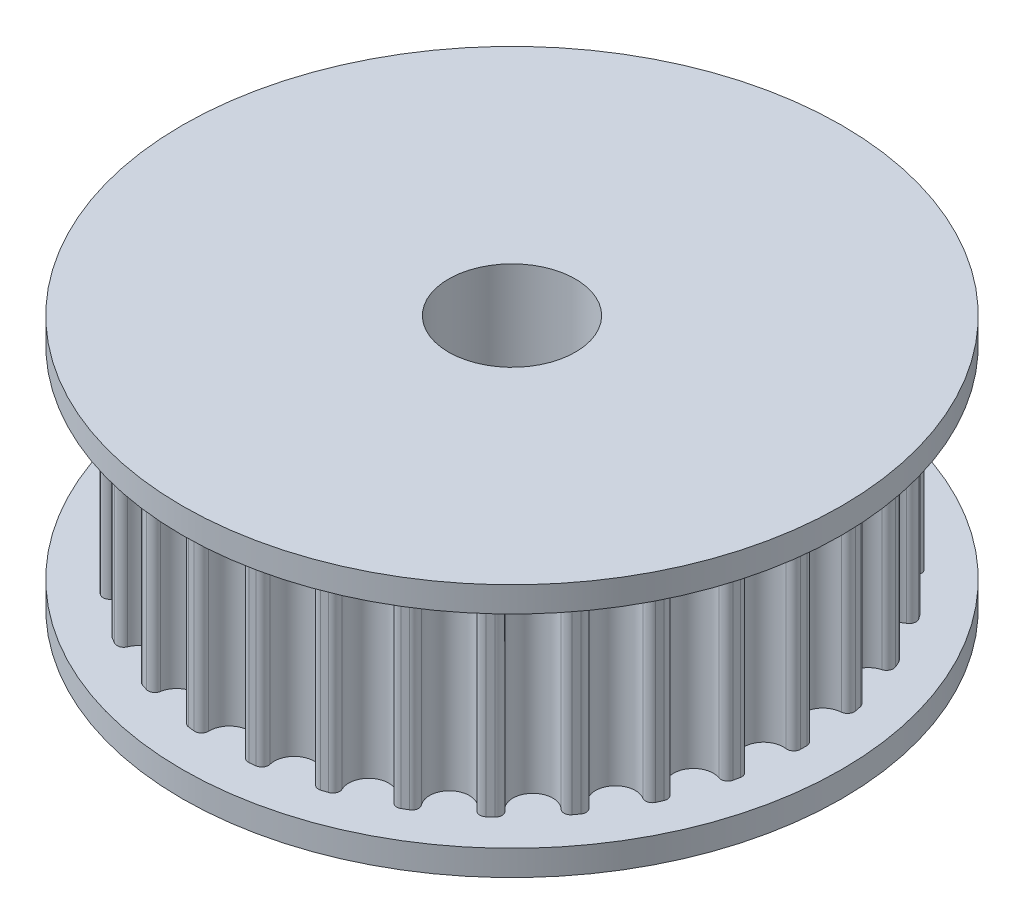
from build123d import *

# Parameters (mm, degrees)
SKETCH1_R           = 5
BOSS_EXTRUDE1_DEPTH = 8
SKETCH2_R           = 26
SKETCH2_R_2         = 5
BOSS_EXTRUDE3_DEPTH = 2


with BuildPart() as part:
    # Sketch1 → Boss-Extrude1 (new, symmetric)
    with BuildSketch(Plane(origin=(0, 0, 0), x_dir=(1, 0, 0), z_dir=(0, 1, 0))):
        with BuildLine():
            ThreePointArc((22.392975349, 0.771229223), (20.603750247, 2.165541413), (22.063982683, 3.901385353))
            ThreePointArc((22.063982683, 3.901385353), (22.451945402, 4.109740228), (22.551013278, 4.538823415))
            ThreePointArc((22.551013278, 4.538823415), (22.526119248, 4.660801376), (22.500565447, 4.782642827))
            ThreePointArc((22.500565447, 4.782642827), (22.474352623, 4.904344198), (22.447481544, 5.025901925))
            ThreePointArc((22.447481544, 5.025901925), (22.182454682, 5.377594386), (21.74328754, 5.410137381))
            ThreePointArc((21.74328754, 5.410137381), (19.703267494, 6.401979689), (20.770688099, 8.403490669))
            ThreePointArc((20.770688099, 8.403490669), (21.106853488, 8.687954474), (21.114545081, 9.128258533))
            ThreePointArc((21.114545081, 9.128258533), (21.064834401, 9.242395224), (21.01450675, 9.356261213))
            ThreePointArc((21.01450675, 9.356261213), (20.963563602, 9.469853164), (20.912006448, 9.583167752))
            ThreePointArc((20.912006448, 9.583167752), (20.579650084, 9.872072706), (20.143313728, 9.812596575))
            ThreePointArc((20.143313728, 9.812596575), (17.941657404, 10.358620732), (18.569614776, 12.538323118))
            ThreePointArc((18.569614776, 12.538323118), (18.839290794, 12.886463421), (18.755269946, 13.318744952))
            ThreePointArc((18.755269946, 13.318744952), (18.682915211, 13.420052051), (18.61001327, 13.520966087))
            ThreePointArc((18.61001327, 13.520966087), (18.536566257, 13.621484106), (18.462576323, 13.721603163))
            ThreePointArc((18.462576323, 13.721603163), (18.077416025, 13.935094077), (17.662980449, 13.786198213))
            ThreePointArc((17.662980449, 13.786198213), (15.395910792, 13.862540343), (15.55696018, 16.12517068))
            ThreePointArc((15.55696018, 16.12517068), (15.748360691, 16.521772079), (15.576299516, 16.927138306))
            ThreePointArc((15.576299516, 16.927138306), (15.484462976, 17.011188206), (15.392172909, 17.094739863))
            ThreePointArc((15.392172909, 17.094739863), (15.299432018, 17.177790829), (15.206243019, 17.260338672))
            ThreePointArc((15.206243019, 17.260338672), (14.785112141, 17.389084969), (14.410690168, 17.157276836))
            ThreePointArc((14.410690168, 17.157276836), (12.177289001, 16.760600421), (11.864391774, 19.007270908))
            ThreePointArc((11.864391774, 19.007270908), (11.969151657, 19.435000018), (11.716570054, 19.79573449))
            ThreePointArc((11.716570054, 19.79573449), (11.609265406, 19.858853808), (11.501620732, 19.921391477))
            ThreePointArc((11.501620732, 19.921391477), (11.393639185, 19.983345665), (11.285323928, 20.044714557))
            ThreePointArc((11.285323928, 20.044714557), (10.84662791, 20.083089406), (10.528583576, 19.77850013))
            ThreePointArc((10.528583576, 19.77850013), (8.426461247, 18.926141834), (7.653292516, 21.058662189))
            ThreePointArc((7.653292516, 21.058662189), (7.666833261, 21.498825197), (7.344770259, 21.799162087))
            ThreePointArc((7.344770259, 21.799162087), (7.22668723, 21.838592206), (7.108392538, 21.87738269))
            ThreePointArc((7.108392538, 21.87738269), (6.989889647, 21.915532404), (6.871182028, 21.953040231))
            ThreePointArc((6.871182028, 21.953040231), (6.434093991, 21.899366466), (6.18632736, 21.535308062))
            ThreePointArc((6.18632736, 21.535308062), (4.307356702, 20.264520032), (3.10770765, 22.189688882))
            ThreePointArc((3.10770765, 22.189688882), (3.029437462, 22.623048551), (2.651968758, 22.849861696))
            ThreePointArc((2.651968758, 22.849861696), (2.528268145, 22.86387933), (2.40449348, 22.8772273))
            ThreePointArc((2.40449348, 22.8772273), (2.28064839, 22.889905215), (2.156736502, 22.901912704))
            ThreePointArc((2.156736502, 22.901912704), (1.74035929, 22.758536127), (1.573698953, 22.350919693))
            ThreePointArc((1.573698953, 22.350919693), (0, 20.717241464), (-1.573698953, 22.350919693))
            ThreePointArc((-1.573698953, 22.350919693), (-1.74035929, 22.758536127), (-2.156736502, 22.901912704))
            ThreePointArc((-2.156736502, 22.901912704), (-2.28064839, 22.889905215), (-2.40449348, 22.8772273))
            ThreePointArc((-2.40449348, 22.8772273), (-2.528268145, 22.86387933), (-2.651968758, 22.849861696))
            ThreePointArc((-2.651968758, 22.849861696), (-3.029437462, 22.623048551), (-3.10770765, 22.189688882))
            ThreePointArc((-3.10770765, 22.189688882), (-4.307356702, 20.264520032), (-6.18632736, 21.535308062))
            ThreePointArc((-6.18632736, 21.535308062), (-6.434093991, 21.899366466), (-6.871182028, 21.953040231))
            ThreePointArc((-6.871182028, 21.953040231), (-6.989889647, 21.915532404), (-7.108392538, 21.87738269))
            ThreePointArc((-7.108392538, 21.87738269), (-7.22668723, 21.838592206), (-7.344770259, 21.799162087))
            ThreePointArc((-7.344770259, 21.799162087), (-7.666833261, 21.498825197), (-7.653292516, 21.058662189))
            ThreePointArc((-7.653292516, 21.058662189), (-8.426461247, 18.926141834), (-10.528583576, 19.77850013))
            ThreePointArc((-10.528583576, 19.77850013), (-10.84662791, 20.083089406), (-11.285323928, 20.044714557))
            ThreePointArc((-11.285323928, 20.044714557), (-11.393639185, 19.983345665), (-11.501620732, 19.921391477))
            ThreePointArc((-11.501620732, 19.921391477), (-11.609265406, 19.858853808), (-11.716570054, 19.79573449))
            ThreePointArc((-11.716570054, 19.79573449), (-11.969151657, 19.435000018), (-11.864391774, 19.007270908))
            ThreePointArc((-11.864391774, 19.007270908), (-12.177289001, 16.760600421), (-14.410690168, 17.157276836))
            ThreePointArc((-14.410690168, 17.157276836), (-14.785112141, 17.389084969), (-15.206243019, 17.260338672))
            ThreePointArc((-15.206243019, 17.260338672), (-15.299432018, 17.177790829), (-15.392172909, 17.094739863))
            ThreePointArc((-15.392172909, 17.094739863), (-15.484462976, 17.011188206), (-15.576299516, 16.927138306))
            ThreePointArc((-15.576299516, 16.927138306), (-15.748360691, 16.521772079), (-15.55696018, 16.12517068))
            ThreePointArc((-15.55696018, 16.12517068), (-15.395910792, 13.862540343), (-17.662980449, 13.786198213))
            ThreePointArc((-17.662980449, 13.786198213), (-18.077416025, 13.935094077), (-18.462576323, 13.721603163))
            ThreePointArc((-18.462576323, 13.721603163), (-18.536566257, 13.621484106), (-18.61001327, 13.520966087))
            ThreePointArc((-18.61001327, 13.520966087), (-18.682915211, 13.420052051), (-18.755269946, 13.318744952))
            ThreePointArc((-18.755269946, 13.318744952), (-18.839290794, 12.886463421), (-18.569614776, 12.538323118))
            ThreePointArc((-18.569614776, 12.538323118), (-17.941657404, 10.358620732), (-20.143313728, 9.812596575))
            ThreePointArc((-20.143313728, 9.812596575), (-20.579650084, 9.872072706), (-20.912006448, 9.583167752))
            ThreePointArc((-20.912006448, 9.583167752), (-20.963563602, 9.469853164), (-21.01450675, 9.356261213))
            ThreePointArc((-21.01450675, 9.356261213), (-21.064834401, 9.242395224), (-21.114545081, 9.128258533))
            ThreePointArc((-21.114545081, 9.128258533), (-21.106853488, 8.687954474), (-20.770688099, 8.403490669))
            ThreePointArc((-20.770688099, 8.403490669), (-19.703267494, 6.401979689), (-21.74328754, 5.410137381))
            ThreePointArc((-21.74328754, 5.410137381), (-22.182454682, 5.377594386), (-22.447481544, 5.025901925))
            ThreePointArc((-22.447481544, 5.025901925), (-22.474352623, 4.904344198), (-22.500565447, 4.782642827))
            ThreePointArc((-22.500565447, 4.782642827), (-22.526119248, 4.660801376), (-22.551013278, 4.538823415))
            ThreePointArc((-22.551013278, 4.538823415), (-22.451945402, 4.109740228), (-22.063982683, 3.901385353))
            ThreePointArc((-22.063982683, 3.901385353), (-20.603750247, 2.165541413), (-22.392975349, 0.771229223))
            ThreePointArc((-22.392975349, 0.771229223), (-22.815779567, 0.648089387), (-23.001893982, 0.248980067))
            ThreePointArc((-23.001893982, 0.248980067), (-23.002904591, 0.124491857), (-23.003241464, 0))
            ThreePointArc((-23.003241464, 0), (-23.002904591, -0.124491857), (-23.001893982, -0.248980067))
            ThreePointArc((-23.001893982, -0.248980067), (-22.815779567, -0.648089387), (-22.392975349, -0.771229223))
            ThreePointArc((-22.392975349, -0.771229223), (-20.603750247, -2.165541413), (-22.063982683, -3.901385353))
            ThreePointArc((-22.063982683, -3.901385353), (-22.451945402, -4.109740228), (-22.551013278, -4.538823415))
            ThreePointArc((-22.551013278, -4.538823415), (-22.526119248, -4.660801376), (-22.500565447, -4.782642827))
            ThreePointArc((-22.500565447, -4.782642827), (-22.474352623, -4.904344198), (-22.447481544, -5.025901925))
            ThreePointArc((-22.447481544, -5.025901925), (-22.182454682, -5.377594386), (-21.74328754, -5.410137381))
            ThreePointArc((-21.74328754, -5.410137381), (-19.703267494, -6.401979689), (-20.770688099, -8.403490669))
            ThreePointArc((-20.770688099, -8.403490669), (-21.106853488, -8.687954474), (-21.114545081, -9.128258533))
            ThreePointArc((-21.114545081, -9.128258533), (-21.064834401, -9.242395224), (-21.01450675, -9.356261213))
            ThreePointArc((-21.01450675, -9.356261213), (-20.963563602, -9.469853164), (-20.912006448, -9.583167752))
            ThreePointArc((-20.912006448, -9.583167752), (-20.579650084, -9.872072706), (-20.143313728, -9.812596575))
            ThreePointArc((-20.143313728, -9.812596575), (-17.941657404, -10.358620732), (-18.569614776, -12.538323118))
            ThreePointArc((-18.569614776, -12.538323118), (-18.839290794, -12.886463421), (-18.755269946, -13.318744952))
            ThreePointArc((-18.755269946, -13.318744952), (-18.682915211, -13.420052051), (-18.61001327, -13.520966087))
            ThreePointArc((-18.61001327, -13.520966087), (-18.536566257, -13.621484106), (-18.462576323, -13.721603163))
            ThreePointArc((-18.462576323, -13.721603163), (-18.077416025, -13.935094077), (-17.662980449, -13.786198213))
            ThreePointArc((-17.662980449, -13.786198213), (-15.395910792, -13.862540343), (-15.55696018, -16.12517068))
            ThreePointArc((-15.55696018, -16.12517068), (-15.748360691, -16.521772079), (-15.576299516, -16.927138306))
            ThreePointArc((-15.576299516, -16.927138306), (-15.484462976, -17.011188206), (-15.392172909, -17.094739863))
            ThreePointArc((-15.392172909, -17.094739863), (-15.299432018, -17.177790829), (-15.206243019, -17.260338672))
            ThreePointArc((-15.206243019, -17.260338672), (-14.785112141, -17.389084969), (-14.410690168, -17.157276836))
            ThreePointArc((-14.410690168, -17.157276836), (-12.177289001, -16.760600421), (-11.864391774, -19.007270908))
            ThreePointArc((-11.864391774, -19.007270908), (-11.969151657, -19.435000018), (-11.716570054, -19.79573449))
            ThreePointArc((-11.716570054, -19.79573449), (-11.609265406, -19.858853808), (-11.501620732, -19.921391477))
            ThreePointArc((-11.501620732, -19.921391477), (-11.393639185, -19.983345665), (-11.285323928, -20.044714557))
            ThreePointArc((-11.285323928, -20.044714557), (-10.84662791, -20.083089406), (-10.528583576, -19.77850013))
            ThreePointArc((-10.528583576, -19.77850013), (-8.426461247, -18.926141834), (-7.653292516, -21.058662189))
            ThreePointArc((-7.653292516, -21.058662189), (-7.666833261, -21.498825197), (-7.344770259, -21.799162087))
            ThreePointArc((-7.344770259, -21.799162087), (-7.22668723, -21.838592206), (-7.108392538, -21.87738269))
            ThreePointArc((-7.108392538, -21.87738269), (-6.989889647, -21.915532404), (-6.871182028, -21.953040231))
            ThreePointArc((-6.871182028, -21.953040231), (-6.434093991, -21.899366466), (-6.18632736, -21.535308062))
            ThreePointArc((-6.18632736, -21.535308062), (-4.307356702, -20.264520032), (-3.10770765, -22.189688882))
            ThreePointArc((-3.10770765, -22.189688882), (-3.029437462, -22.623048551), (-2.651968758, -22.849861696))
            ThreePointArc((-2.651968758, -22.849861696), (-2.528268145, -22.86387933), (-2.40449348, -22.8772273))
            ThreePointArc((-2.40449348, -22.8772273), (-2.28064839, -22.889905215), (-2.156736502, -22.901912704))
            ThreePointArc((-2.156736502, -22.901912704), (-1.74035929, -22.758536127), (-1.573698953, -22.350919693))
            ThreePointArc((-1.573698953, -22.350919693), (0, -20.717241464), (1.573698953, -22.350919693))
            ThreePointArc((1.573698953, -22.350919693), (1.74035929, -22.758536127), (2.156736502, -22.901912704))
            ThreePointArc((2.156736502, -22.901912704), (2.28064839, -22.889905215), (2.40449348, -22.8772273))
            ThreePointArc((2.40449348, -22.8772273), (2.528268145, -22.86387933), (2.651968758, -22.849861696))
            ThreePointArc((2.651968758, -22.849861696), (3.029437462, -22.623048551), (3.10770765, -22.189688882))
            ThreePointArc((3.10770765, -22.189688882), (4.307356702, -20.264520032), (6.18632736, -21.535308062))
            ThreePointArc((6.18632736, -21.535308062), (6.434093991, -21.899366466), (6.871182028, -21.953040231))
            ThreePointArc((6.871182028, -21.953040231), (6.989889647, -21.915532404), (7.108392538, -21.87738269))
            ThreePointArc((7.108392538, -21.87738269), (7.22668723, -21.838592206), (7.344770259, -21.799162087))
            ThreePointArc((7.344770259, -21.799162087), (7.666833261, -21.498825197), (7.653292516, -21.058662189))
            ThreePointArc((7.653292516, -21.058662189), (8.426461247, -18.926141834), (10.528583576, -19.77850013))
            ThreePointArc((10.528583576, -19.77850013), (10.84662791, -20.083089406), (11.285323928, -20.044714557))
            ThreePointArc((11.285323928, -20.044714557), (11.393639185, -19.983345665), (11.501620732, -19.921391477))
            ThreePointArc((11.501620732, -19.921391477), (11.609265406, -19.858853808), (11.716570054, -19.79573449))
            ThreePointArc((11.716570054, -19.79573449), (11.969151657, -19.435000018), (11.864391774, -19.007270908))
            ThreePointArc((11.864391774, -19.007270908), (12.177289001, -16.760600421), (14.410690168, -17.157276836))
            ThreePointArc((14.410690168, -17.157276836), (14.785112141, -17.389084969), (15.206243019, -17.260338672))
            ThreePointArc((15.206243019, -17.260338672), (15.299432018, -17.177790829), (15.392172909, -17.094739863))
            ThreePointArc((15.392172909, -17.094739863), (15.484462976, -17.011188206), (15.576299516, -16.927138306))
            ThreePointArc((15.576299516, -16.927138306), (15.748360691, -16.521772079), (15.55696018, -16.12517068))
            ThreePointArc((15.55696018, -16.12517068), (15.395910792, -13.862540343), (17.662980449, -13.786198213))
            ThreePointArc((17.662980449, -13.786198213), (18.077416025, -13.935094077), (18.462576323, -13.721603163))
            ThreePointArc((18.462576323, -13.721603163), (18.536566257, -13.621484106), (18.61001327, -13.520966087))
            ThreePointArc((18.61001327, -13.520966087), (18.682915211, -13.420052051), (18.755269946, -13.318744952))
            ThreePointArc((18.755269946, -13.318744952), (18.839290794, -12.886463421), (18.569614776, -12.538323118))
            ThreePointArc((18.569614776, -12.538323118), (17.941657404, -10.358620732), (20.143313728, -9.812596575))
            ThreePointArc((20.143313728, -9.812596575), (20.579650084, -9.872072706), (20.912006448, -9.583167752))
            ThreePointArc((20.912006448, -9.583167752), (20.963563602, -9.469853164), (21.01450675, -9.356261213))
            ThreePointArc((21.01450675, -9.356261213), (21.064834401, -9.242395224), (21.114545081, -9.128258533))
            ThreePointArc((21.114545081, -9.128258533), (21.106853488, -8.687954474), (20.770688099, -8.403490669))
            ThreePointArc((20.770688099, -8.403490669), (19.703267494, -6.401979689), (21.74328754, -5.410137381))
            ThreePointArc((21.74328754, -5.410137381), (22.182454682, -5.377594386), (22.447481544, -5.025901925))
            ThreePointArc((22.447481544, -5.025901925), (22.474352623, -4.904344198), (22.500565447, -4.782642827))
            ThreePointArc((22.500565447, -4.782642827), (22.526119248, -4.660801376), (22.551013278, -4.538823415))
            ThreePointArc((22.551013278, -4.538823415), (22.451945402, -4.109740228), (22.063982683, -3.901385353))
            ThreePointArc((22.063982683, -3.901385353), (20.603750247, -2.165541413), (22.392975349, -0.771229223))
            ThreePointArc((22.392975349, -0.771229223), (22.815779567, -0.648089387), (23.001893982, -0.248980067))
            ThreePointArc((23.001893982, -0.248980067), (23.002904591, -0.124491857), (23.003241464, 0))
            ThreePointArc((23.003241464, 0), (23.002904591, 0.124491857), (23.001893982, 0.248980067))
            ThreePointArc((23.001893982, 0.248980067), (22.815779567, 0.648089387), (22.392975349, 0.771229223))
        make_face()
        with Locations(Location((0, 0, 0), (0, 0, 270))):
            Circle(SKETCH1_R, mode=Mode.SUBTRACT)
    extrude(amount=BOSS_EXTRUDE1_DEPTH, both=True)

    # Sketch2 → Boss-Extrude3 (add)
    with BuildSketch(Plane(origin=(0, 8, 0), x_dir=(1, 0, 0), z_dir=(0, 1, 0))):
        with Locations(Location((0, 0, 0), (0, 0, 270))):
            Circle(SKETCH2_R)
        with Locations(Location((0, 0, 0), (0, 0, 270))):
            Circle(SKETCH2_R_2, mode=Mode.SUBTRACT)
    boss_extrude3 = extrude(amount=BOSS_EXTRUDE3_DEPTH)

    # Mirror1: Boss-Extrude3 across plane
    add(boss_extrude3.mirror(Plane.ZX))


solid = part.part
